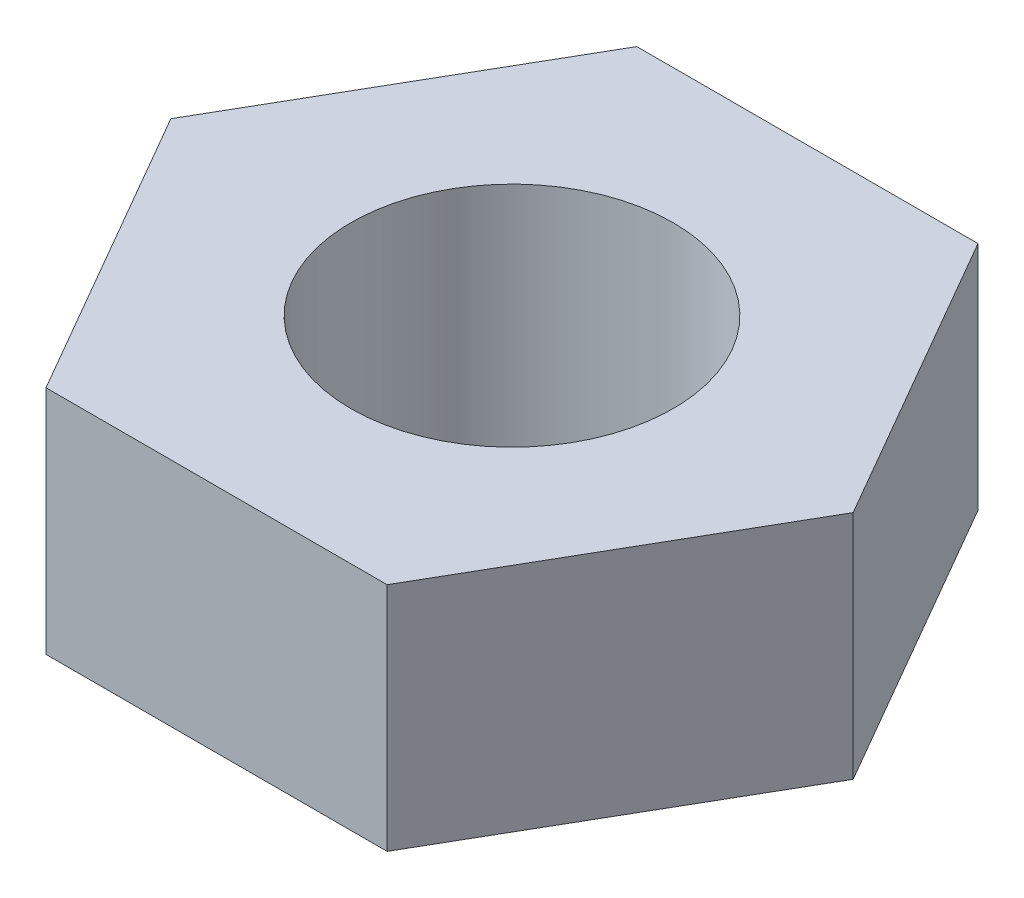
from build123d import *

# Parameters (mm, degrees)
EXTRUDE_1_DEPTH          = 2.15
CUT_EXTRUDE_1_DEPTH      = 3
CUT_EXTRUDE_1_DEPTH_BACK = 0.8
SKETCH_3_R               = 1.5


with BuildPart() as part:
    # 草图1 → 凸台-拉伸1 (new body)
    with BuildSketch(Plane(origin=(0, 0, 0), x_dir=(1, 0, 0), z_dir=(0, 1, 0))):
        Polygon((3.175426481, 0), (1.58771324, 2.75), (-1.58771324, 2.75), (-3.175426481, 0), (-1.58771324, -2.75), (1.58771324, -2.75), align=None)
    extrude(amount=EXTRUDE_1_DEPTH)

    # 草图3 → 切除-拉伸1 (cut, two sides: drawn at the far end of the back side and taken through both)
    with BuildSketch(Plane(origin=(0, 0, 0), x_dir=(1, 0, 0), z_dir=(0, 1, 0)).offset(-CUT_EXTRUDE_1_DEPTH_BACK)):
        with Locations(Location((0, 0, 0), (0, 0, 270))):
            Circle(SKETCH_3_R)
    extrude(amount=CUT_EXTRUDE_1_DEPTH + CUT_EXTRUDE_1_DEPTH_BACK, mode=Mode.SUBTRACT)


solid = part.part
